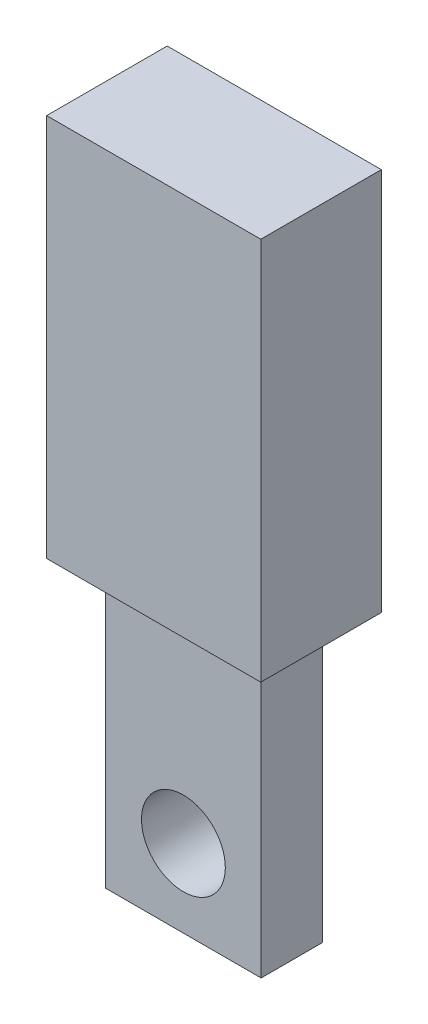
from build123d import *

# Parameters (mm, degrees)
EXTRUDE2_DEPTH          = 59.309
EXTRUDE2_DEPTH_BACK     = 59.309
SKETCH1_W               = 64.516
SKETCH1_H               = 25.4
CUT_EXTRUDE1_DEPTH      = 69.698078903
CUT_EXTRUDE1_DEPTH_BACK = 69.698078903
SKETCH2_R               = 17.399
SKETCH3_W               = 88.9
SKETCH3_H               = 50.038
EXTRUDE3_DEPTH          = 159.258


with BuildPart() as part:
    # Sketch1 → Extrude2 (new, two sides: drawn at the far end of the back side and taken through both)
    with BuildSketch(Plane(origin=(0, 0, 0), x_dir=(1, 0, 0), z_dir=(0, 1, 0)).offset(-EXTRUDE2_DEPTH_BACK)):
        Rectangle(SKETCH1_W, SKETCH1_H)
    extrude(amount=EXTRUDE2_DEPTH + EXTRUDE2_DEPTH_BACK)

    # Sketch2 → Cut-Extrude1 (cut, two sides: drawn at the far end of the back side and taken through both)
    with BuildSketch(Plane.XY.offset(-CUT_EXTRUDE1_DEPTH_BACK)):
        with Locations((0, -27.051)):
            Circle(SKETCH2_R)
    extrude(amount=CUT_EXTRUDE1_DEPTH + CUT_EXTRUDE1_DEPTH_BACK, mode=Mode.SUBTRACT)

    # Sketch3 → Extrude3 (add)
    with BuildSketch(Plane(origin=(0, 59.309, 0), x_dir=(-1, 0, 0), z_dir=(0, 1, 0))):
        Rectangle(SKETCH3_W, SKETCH3_H)
    extrude(amount=EXTRUDE3_DEPTH)


solid = part.part
